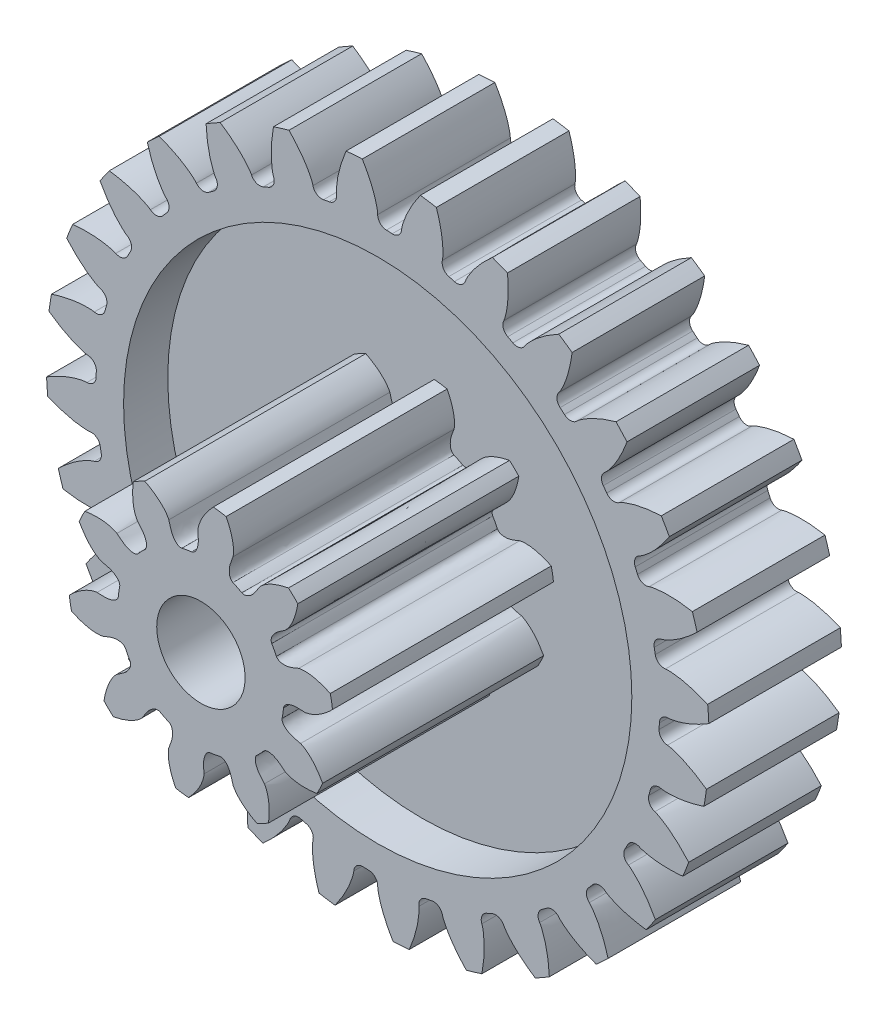
from build123d import *

# Parameters (mm, degrees)
ESQUISSE1_R             = 1
BOSS_EXTRU_1_DEPTH      = 3
ESQUISSE2_R             = 5.75
ENL_V_MAT_EXTRU_1_DEPTH = 1
ESQUISSE3_R             = 1
BOSS_EXTRU_2_DEPTH      = 5


with BuildPart() as part:
    # Esquisse1 → Boss.-Extru.1 (new body)
    with BuildSketch(Plane.XY):
        with BuildLine():
            ThreePointArc((7.491868518, 0.349150543), (7.48109955, 0.532117964), (7.465862795, 0.714767599))
            add(Edge.make_bspline(
                [(6.511775734, 0.931053619), (6.54533459, 0.935851864), (6.691230758, 0.932883331), (6.92755526, 0.897904294), (7.210754579, 0.816287714), (7.382633754, 0.750372838), (7.465862795, 0.714767599)],
                knots=[0, 0, 0, 0, 0.101700454, 0.434977009, 0.714423103, 0.984887496, 0.984887496, 0.984887496, 0.984887496], degree=3))
            ThreePointArc((6.511775734, 0.931053619), (6.361956751, 0.966352964), (6.279971624, 1.096622724))
            ThreePointArc((6.279971624, 1.096622724), (6.268309408, 1.161431083), (6.255978398, 1.226115524))
            ThreePointArc((6.255978398, 1.226115524), (6.285849036, 1.377110609), (6.413075806, 1.463742704))
            add(Edge.make_bspline(
                [(6.413075806, 1.463742704), (6.44612601, 1.471286197), (6.581273617, 1.526328257), (6.789378175, 1.643653855), (7.024536913, 1.821315017), (7.161390753, 1.944433854), (7.226338428, 2.00749419)],
                knots=[0, 0, 0, 0, 0.101700454, 0.434977009, 0.714423103, 0.984887496, 0.984887496, 0.984887496, 0.984887496], degree=3))
            ThreePointArc((7.226338428, 2.00749419), (7.175125379, 2.183477914), (7.119627274, 2.358157645))
            add(Edge.make_bspline(
                [(6.141333, 2.356716579), (6.172982756, 2.36886207), (6.315881563, 2.398432916), (6.554064484, 2.416918025), (6.848324803, 2.40036552), (7.030562047, 2.374349982), (7.119627274, 2.358157645)],
                knots=[0, 0, 0, 0, 0.101700454, 0.434977009, 0.714423103, 0.984887496, 0.984887496, 0.984887496, 0.984887496], degree=3))
            ThreePointArc((6.141333, 2.356716579), (5.987415449, 2.357793036), (5.878498112, 2.466553254))
            ThreePointArc((5.878498112, 2.466553254), (5.852707075, 2.527141645), (5.826291587, 2.587460404))
            ThreePointArc((5.826291587, 2.587460404), (5.821813738, 2.741316569), (5.926573213, 2.854087236))
            add(Edge.make_bspline(
                [(5.926573213, 2.854087236), (5.957116194, 2.86879596), (6.076627358, 2.952531173), (6.253406899, 3.113222794), (6.443136388, 3.338757362), (6.549162498, 3.489242196), (6.598449554, 3.565173695)],
                knots=[0, 0, 0, 0, 0.101700454, 0.434977009, 0.714423103, 0.984887496, 0.984887496, 0.984887496, 0.984887496], degree=3))
            ThreePointArc((6.598449554, 3.565173695), (6.50936046, 3.725349165), (6.416383912, 3.88329982))
            add(Edge.make_bspline(
                [(5.462938185, 3.664203929), (5.49109179, 3.683087641), (5.623827693, 3.743715059), (5.851925548, 3.814737394), (6.142491424, 3.864078976), (6.325948603, 3.879267303), (6.416383912, 3.88329982)],
                knots=[0, 0, 0, 0, 0.101700454, 0.434977009, 0.714423103, 0.984887496, 0.984887496, 0.984887496, 0.984887496], degree=3))
            ThreePointArc((5.462938185, 3.664203929), (5.312640134, 3.631003519), (5.182252157, 3.712800504))
            ThreePointArc((5.182252157, 3.712800504), (5.14362557, 3.766130772), (5.104450187, 3.819059215))
            ThreePointArc((5.104450187, 3.819059215), (5.06584839, 3.96806147), (5.142887492, 4.101315917))
            add(Edge.make_bspline(
                [(5.142887492, 4.101315917), (5.169391697, 4.122452315), (5.267273629, 4.230681847), (5.403863688, 4.426681742), (5.5386501, 4.688780471), (5.608531889, 4.859085365), (5.639686867, 4.944080505)],
                knots=[0, 0, 0, 0, 0.101700454, 0.434977009, 0.714423103, 0.984887496, 0.984887496, 0.984887496, 0.984887496], degree=3))
            ThreePointArc((5.639686867, 4.944080505), (5.517189028, 5.080415852), (5.391396269, 5.213717126))
            add(Edge.make_bspline(
                [(4.510608839, 4.787952794), (4.533854553, 4.812627817), (4.64977162, 4.901271697), (4.856346629, 5.021269902), (5.128647877, 5.134031378), (5.30412568, 5.189661964), (5.391396269, 5.213717126)],
                knots=[0, 0, 0, 0, 0.101700454, 0.434977009, 0.714423103, 0.984887496, 0.984887496, 0.984887496, 0.984887496], degree=3))
            ThreePointArc((4.510608839, 4.787952794), (4.37146686, 4.722140325), (4.22614644, 4.772872434))
            ThreePointArc((4.22614644, 4.772872434), (4.176621201, 4.816270376), (4.12665034, 4.85915445))
            ThreePointArc((4.12665034, 4.85915445), (4.05586025, 4.995831199), (4.101315917, 5.142887492))
            add(Edge.make_bspline(
                [(4.101315917, 5.142887492), (4.122452315, 5.169391697), (4.193796806, 5.296688467), (4.283348187, 5.518168384), (4.356432769, 5.803688548), (4.386666071, 5.985273704), (4.398126732, 6.075070473)],
                knots=[0, 0, 0, 0, 0.101700454, 0.434977009, 0.714423103, 0.984887496, 0.984887496, 0.984887496, 0.984887496], degree=3))
            ThreePointArc((4.398126732, 6.075070473), (4.248362699, 6.180729275), (4.096061504, 6.282696886))
            add(Edge.make_bspline(
                [(3.332098731, 5.671613712), (3.349270916, 5.700842739), (3.442556582, 5.813058106), (3.617250211, 5.976014969), (3.85763251, 6.146542008), (4.016331748, 6.239825304), (4.096061504, 6.282696886)],
                knots=[0, 0, 0, 0, 0.101700454, 0.434977009, 0.714423103, 0.984887496, 0.984887496, 0.984887496, 0.984887496], degree=3))
            ThreePointArc((3.332098731, 5.671613712), (3.211089984, 5.576489296), (3.058124094, 5.59361261))
            ThreePointArc((3.058124094, 5.59361261), (3.000183606, 5.624902073), (2.941923014, 5.655591391))
            ThreePointArc((2.941923014, 5.655591391), (2.842494341, 5.773089092), (2.854087236, 5.926573213))
            add(Edge.make_bspline(
                [(2.854087236, 5.926573213), (2.86879596, 5.957116194), (2.9100255, 6.097097011), (2.948047723, 6.33295102), (2.955765708, 6.627575448), (2.9448345, 6.811335427), (2.936026156, 6.901431041)],
                knots=[0, 0, 0, 0, 0.101700454, 0.434977009, 0.714423103, 0.984887496, 0.984887496, 0.984887496, 0.984887496], degree=3))
            ThreePointArc((2.936026156, 6.901431041), (2.766505726, 6.971115124), (2.595333111, 7.036635989))
            add(Edge.make_bspline(
                [(1.986503278, 6.270876237), (1.996740851, 6.303193602), (2.062717382, 6.433353509), (2.196769764, 6.631097693), (2.393179341, 6.850839356), (2.527142172, 6.977097748), (2.595333111, 7.036635989)],
                knots=[0, 0, 0, 0, 0.101700454, 0.434977009, 0.714423103, 0.984887496, 0.984887496, 0.984887496, 0.984887496], degree=3))
            ThreePointArc((1.986503278, 6.270876237), (1.889695647, 6.151209809), (1.736754636, 6.133865693))
            ThreePointArc((1.736754636, 6.133865693), (1.673304276, 6.151477692), (1.609675384, 6.168433363))
            ThreePointArc((1.609675384, 6.168433363), (1.486593897, 6.26086019), (1.463742704, 6.413075806))
            add(Edge.make_bspline(
                [(1.463742704, 6.413075806), (1.471286197, 6.44612601), (1.480333363, 6.591771651), (1.464919836, 6.830173049), (1.406884212, 7.11912804), (1.35533663, 7.295848351), (1.32670097, 7.381725038)],
                knots=[0, 0, 0, 0, 0.101700454, 0.434977009, 0.714423103, 0.984887496, 0.984887496, 0.984887496, 0.984887496], degree=3))
            ThreePointArc((1.32670097, 7.381725038), (1.145924603, 7.411940151), (0.964463879, 7.437728781))
            add(Edge.make_bspline(
                [(0.541296257, 6.555690842), (0.544085862, 6.589476018), (0.57944492, 6.731053703), (0.666134108, 6.953669488), (0.808722167, 7.211607012), (0.911231134, 7.364509376), (0.964463879, 7.437728781)],
                knots=[0, 0, 0, 0, 0.101700454, 0.434977009, 0.714423103, 0.984887496, 0.984887496, 0.984887496, 0.984887496], degree=3))
            ThreePointArc((0.541296257, 6.555690842), (0.47354408, 6.417482977), (0.328297049, 6.366541137))
            ThreePointArc((0.328297049, 6.366541137), (0.262518483, 6.369592534), (0.196711908, 6.37196433))
            ThreePointArc((0.196711908, 6.37196433), (0.056149427, 6.434685616), (0, 6.578))
            add(Edge.make_bspline(
                [(0, 6.578), (0, 6.611900151), (-0.023588869, 6.755907336), (-0.091665249, 6.984901681), (-0.212544333, 7.253697825), (-0.302123478, 7.414516973), (-0.349150543, 7.491868518)],
                knots=[0, 0, 0, 0, 0.101700454, 0.434977009, 0.714423103, 0.984887496, 0.984887496, 0.984887496, 0.984887496], degree=3))
            ThreePointArc((-0.349150543, 7.491868518), (-0.532117964, 7.48109955), (-0.714767599, 7.465862795))
            add(Edge.make_bspline(
                [(-0.931053619, 6.511775734), (-0.935851864, 6.54533459), (-0.932883331, 6.691230758), (-0.897904294, 6.92755526), (-0.816287714, 7.210754579), (-0.750372838, 7.382633754), (-0.714767599, 7.465862795)],
                knots=[0, 0, 0, 0, 0.101700454, 0.434977009, 0.714423103, 0.984887496, 0.984887496, 0.984887496, 0.984887496], degree=3))
            ThreePointArc((-0.931053619, 6.511775734), (-0.966352964, 6.361956751), (-1.096622724, 6.279971624))
            ThreePointArc((-1.096622724, 6.279971624), (-1.161431083, 6.268309408), (-1.226115524, 6.255978398))
            ThreePointArc((-1.226115524, 6.255978398), (-1.377110609, 6.285849036), (-1.463742704, 6.413075806))
            add(Edge.make_bspline(
                [(-1.463742704, 6.413075806), (-1.471286197, 6.44612601), (-1.526328257, 6.581273617), (-1.643653855, 6.789378175), (-1.821315017, 7.024536913), (-1.944433854, 7.161390753), (-2.00749419, 7.226338428)],
                knots=[0, 0, 0, 0, 0.101700454, 0.434977009, 0.714423103, 0.984887496, 0.984887496, 0.984887496, 0.984887496], degree=3))
            ThreePointArc((-2.00749419, 7.226338428), (-2.183477914, 7.175125379), (-2.358157645, 7.119627274))
            add(Edge.make_bspline(
                [(-2.356716579, 6.141333), (-2.36886207, 6.172982756), (-2.398432916, 6.315881563), (-2.416918025, 6.554064484), (-2.40036552, 6.848324803), (-2.374349982, 7.030562047), (-2.358157645, 7.119627274)],
                knots=[0, 0, 0, 0, 0.101700454, 0.434977009, 0.714423103, 0.984887496, 0.984887496, 0.984887496, 0.984887496], degree=3))
            ThreePointArc((-2.356716579, 6.141333), (-2.357793036, 5.987415449), (-2.466553254, 5.878498112))
            ThreePointArc((-2.466553254, 5.878498112), (-2.527141645, 5.852707075), (-2.587460404, 5.826291587))
            ThreePointArc((-2.587460404, 5.826291587), (-2.741316569, 5.821813738), (-2.854087236, 5.926573213))
            add(Edge.make_bspline(
                [(-2.854087236, 5.926573213), (-2.86879596, 5.957116194), (-2.952531173, 6.076627358), (-3.113222794, 6.253406899), (-3.338757362, 6.443136388), (-3.489242196, 6.549162498), (-3.565173695, 6.598449554)],
                knots=[0, 0, 0, 0, 0.101700454, 0.434977009, 0.714423103, 0.984887496, 0.984887496, 0.984887496, 0.984887496], degree=3))
            ThreePointArc((-3.565173695, 6.598449554), (-3.725349165, 6.50936046), (-3.88329982, 6.416383912))
            add(Edge.make_bspline(
                [(-3.664203929, 5.462938185), (-3.683087641, 5.49109179), (-3.743715059, 5.623827693), (-3.814737394, 5.851925548), (-3.864078976, 6.142491424), (-3.879267303, 6.325948603), (-3.88329982, 6.416383912)],
                knots=[0, 0, 0, 0, 0.101700454, 0.434977009, 0.714423103, 0.984887496, 0.984887496, 0.984887496, 0.984887496], degree=3))
            ThreePointArc((-3.664203929, 5.462938185), (-3.631003519, 5.312640134), (-3.712800504, 5.182252157))
            ThreePointArc((-3.712800504, 5.182252157), (-3.766130772, 5.14362557), (-3.819059215, 5.104450187))
            ThreePointArc((-3.819059215, 5.104450187), (-3.96806147, 5.06584839), (-4.101315917, 5.142887492))
            add(Edge.make_bspline(
                [(-4.101315917, 5.142887492), (-4.122452315, 5.169391697), (-4.230681847, 5.267273629), (-4.426681742, 5.403863688), (-4.688780471, 5.5386501), (-4.859085365, 5.608531889), (-4.944080505, 5.639686867)],
                knots=[0, 0, 0, 0, 0.101700454, 0.434977009, 0.714423103, 0.984887496, 0.984887496, 0.984887496, 0.984887496], degree=3))
            ThreePointArc((-4.944080505, 5.639686867), (-5.080415852, 5.517189028), (-5.213717126, 5.391396269))
            add(Edge.make_bspline(
                [(-4.787952794, 4.510608839), (-4.812627817, 4.533854553), (-4.901271697, 4.64977162), (-5.021269902, 4.856346629), (-5.134031378, 5.128647877), (-5.189661964, 5.30412568), (-5.213717126, 5.391396269)],
                knots=[0, 0, 0, 0, 0.101700454, 0.434977009, 0.714423103, 0.984887496, 0.984887496, 0.984887496, 0.984887496], degree=3))
            ThreePointArc((-4.787952794, 4.510608839), (-4.722140325, 4.37146686), (-4.772872434, 4.22614644))
            ThreePointArc((-4.772872434, 4.22614644), (-4.816270376, 4.176621201), (-4.85915445, 4.12665034))
            ThreePointArc((-4.85915445, 4.12665034), (-4.995831199, 4.05586025), (-5.142887492, 4.101315917))
            add(Edge.make_bspline(
                [(-5.142887492, 4.101315917), (-5.169391697, 4.122452315), (-5.296688467, 4.193796806), (-5.518168384, 4.283348187), (-5.803688548, 4.356432769), (-5.985273704, 4.386666071), (-6.075070473, 4.398126732)],
                knots=[0, 0, 0, 0, 0.101700454, 0.434977009, 0.714423103, 0.984887496, 0.984887496, 0.984887496, 0.984887496], degree=3))
            ThreePointArc((-6.075070473, 4.398126732), (-6.180729275, 4.248362699), (-6.282696886, 4.096061504))
            add(Edge.make_bspline(
                [(-5.671613712, 3.332098731), (-5.700842739, 3.349270916), (-5.813058106, 3.442556582), (-5.976014969, 3.617250211), (-6.146542008, 3.85763251), (-6.239825304, 4.016331748), (-6.282696886, 4.096061504)],
                knots=[0, 0, 0, 0, 0.101700454, 0.434977009, 0.714423103, 0.984887496, 0.984887496, 0.984887496, 0.984887496], degree=3))
            ThreePointArc((-5.671613712, 3.332098731), (-5.576489296, 3.211089984), (-5.59361261, 3.058124094))
            ThreePointArc((-5.59361261, 3.058124094), (-5.624902073, 3.000183606), (-5.655591391, 2.941923014))
            ThreePointArc((-5.655591391, 2.941923014), (-5.773089092, 2.842494341), (-5.926573213, 2.854087236))
            add(Edge.make_bspline(
                [(-5.926573213, 2.854087236), (-5.957116194, 2.86879596), (-6.097097011, 2.9100255), (-6.33295102, 2.948047723), (-6.627575448, 2.955765708), (-6.811335427, 2.9448345), (-6.901431041, 2.936026156)],
                knots=[0, 0, 0, 0, 0.101700454, 0.434977009, 0.714423103, 0.984887496, 0.984887496, 0.984887496, 0.984887496], degree=3))
            ThreePointArc((-6.901431041, 2.936026156), (-6.971115124, 2.766505726), (-7.036635989, 2.595333111))
            add(Edge.make_bspline(
                [(-6.270876237, 1.986503278), (-6.303193602, 1.996740851), (-6.433353509, 2.062717382), (-6.631097693, 2.196769764), (-6.850839356, 2.393179341), (-6.977097748, 2.527142172), (-7.036635989, 2.595333111)],
                knots=[0, 0, 0, 0, 0.101700454, 0.434977009, 0.714423103, 0.984887496, 0.984887496, 0.984887496, 0.984887496], degree=3))
            ThreePointArc((-6.270876237, 1.986503278), (-6.151209809, 1.889695647), (-6.133865693, 1.736754636))
            ThreePointArc((-6.133865693, 1.736754636), (-6.151477692, 1.673304276), (-6.168433363, 1.609675384))
            ThreePointArc((-6.168433363, 1.609675384), (-6.26086019, 1.486593897), (-6.413075806, 1.463742704))
            add(Edge.make_bspline(
                [(-6.413075806, 1.463742704), (-6.44612601, 1.471286197), (-6.591771651, 1.480333363), (-6.830173049, 1.464919836), (-7.11912804, 1.406884212), (-7.295848351, 1.35533663), (-7.381725038, 1.32670097)],
                knots=[0, 0, 0, 0, 0.101700454, 0.434977009, 0.714423103, 0.984887496, 0.984887496, 0.984887496, 0.984887496], degree=3))
            ThreePointArc((-7.381725038, 1.32670097), (-7.411940151, 1.145924603), (-7.437728781, 0.964463879))
            add(Edge.make_bspline(
                [(-6.555690842, 0.541296257), (-6.589476018, 0.544085862), (-6.731053703, 0.57944492), (-6.953669488, 0.666134108), (-7.211607012, 0.808722167), (-7.364509376, 0.911231134), (-7.437728781, 0.964463879)],
                knots=[0, 0, 0, 0, 0.101700454, 0.434977009, 0.714423103, 0.984887496, 0.984887496, 0.984887496, 0.984887496], degree=3))
            ThreePointArc((-6.555690842, 0.541296257), (-6.417482977, 0.47354408), (-6.366541137, 0.328297049))
            ThreePointArc((-6.366541137, 0.328297049), (-6.369592534, 0.262518483), (-6.37196433, 0.196711908))
            ThreePointArc((-6.37196433, 0.196711908), (-6.434685616, 0.056149427), (-6.578, 0))
            add(Edge.make_bspline(
                [(-6.578, 0), (-6.611900151, 0), (-6.755907336, -0.023588869), (-6.984901681, -0.091665249), (-7.253697825, -0.212544333), (-7.414516973, -0.302123478), (-7.491868518, -0.349150543)],
                knots=[0, 0, 0, 0, 0.101700454, 0.434977009, 0.714423103, 0.984887496, 0.984887496, 0.984887496, 0.984887496], degree=3))
            ThreePointArc((-7.491868518, -0.349150543), (-7.48109955, -0.532117964), (-7.465862795, -0.714767599))
            add(Edge.make_bspline(
                [(-6.511775734, -0.931053619), (-6.54533459, -0.935851864), (-6.691230758, -0.932883331), (-6.92755526, -0.897904294), (-7.210754579, -0.816287714), (-7.382633754, -0.750372838), (-7.465862795, -0.714767599)],
                knots=[0, 0, 0, 0, 0.101700454, 0.434977009, 0.714423103, 0.984887496, 0.984887496, 0.984887496, 0.984887496], degree=3))
            ThreePointArc((-6.511775734, -0.931053619), (-6.361956751, -0.966352964), (-6.279971624, -1.096622724))
            ThreePointArc((-6.279971624, -1.096622724), (-6.268309408, -1.161431083), (-6.255978398, -1.226115524))
            ThreePointArc((-6.255978398, -1.226115524), (-6.285849036, -1.377110609), (-6.413075806, -1.463742704))
            add(Edge.make_bspline(
                [(-6.413075806, -1.463742704), (-6.44612601, -1.471286197), (-6.581273617, -1.526328257), (-6.789378175, -1.643653855), (-7.024536913, -1.821315017), (-7.161390753, -1.944433854), (-7.226338428, -2.00749419)],
                knots=[0, 0, 0, 0, 0.101700454, 0.434977009, 0.714423103, 0.984887496, 0.984887496, 0.984887496, 0.984887496], degree=3))
            ThreePointArc((-7.226338428, -2.00749419), (-7.175125379, -2.183477914), (-7.119627274, -2.358157645))
            add(Edge.make_bspline(
                [(-6.141333, -2.356716579), (-6.172982756, -2.36886207), (-6.315881563, -2.398432916), (-6.554064484, -2.416918025), (-6.848324803, -2.40036552), (-7.030562047, -2.374349982), (-7.119627274, -2.358157645)],
                knots=[0, 0, 0, 0, 0.101700454, 0.434977009, 0.714423103, 0.984887496, 0.984887496, 0.984887496, 0.984887496], degree=3))
            ThreePointArc((-6.141333, -2.356716579), (-5.987415449, -2.357793036), (-5.878498112, -2.466553254))
            ThreePointArc((-5.878498112, -2.466553254), (-5.852707075, -2.527141645), (-5.826291587, -2.587460404))
            ThreePointArc((-5.826291587, -2.587460404), (-5.821813738, -2.741316569), (-5.926573213, -2.854087236))
            add(Edge.make_bspline(
                [(-5.926573213, -2.854087236), (-5.957116194, -2.86879596), (-6.076627358, -2.952531173), (-6.253406899, -3.113222794), (-6.443136388, -3.338757362), (-6.549162498, -3.489242196), (-6.598449554, -3.565173695)],
                knots=[0, 0, 0, 0, 0.101700454, 0.434977009, 0.714423103, 0.984887496, 0.984887496, 0.984887496, 0.984887496], degree=3))
            ThreePointArc((-6.598449554, -3.565173695), (-6.50936046, -3.725349165), (-6.416383912, -3.88329982))
            add(Edge.make_bspline(
                [(-5.462938185, -3.664203929), (-5.49109179, -3.683087641), (-5.623827693, -3.743715059), (-5.851925548, -3.814737394), (-6.142491424, -3.864078976), (-6.325948603, -3.879267303), (-6.416383912, -3.88329982)],
                knots=[0, 0, 0, 0, 0.101700454, 0.434977009, 0.714423103, 0.984887496, 0.984887496, 0.984887496, 0.984887496], degree=3))
            ThreePointArc((-5.462938185, -3.664203929), (-5.312640134, -3.631003519), (-5.182252157, -3.712800504))
            ThreePointArc((-5.182252157, -3.712800504), (-5.14362557, -3.766130772), (-5.104450187, -3.819059215))
            ThreePointArc((-5.104450187, -3.819059215), (-5.06584839, -3.96806147), (-5.142887492, -4.101315917))
            add(Edge.make_bspline(
                [(-5.142887492, -4.101315917), (-5.169391697, -4.122452315), (-5.267273629, -4.230681847), (-5.403863688, -4.426681742), (-5.5386501, -4.688780471), (-5.608531889, -4.859085365), (-5.639686867, -4.944080505)],
                knots=[0, 0, 0, 0, 0.101700454, 0.434977009, 0.714423103, 0.984887496, 0.984887496, 0.984887496, 0.984887496], degree=3))
            ThreePointArc((-5.639686867, -4.944080505), (-5.517189028, -5.080415852), (-5.391396269, -5.213717126))
            add(Edge.make_bspline(
                [(-4.510608839, -4.787952794), (-4.533854553, -4.812627817), (-4.64977162, -4.901271697), (-4.856346629, -5.021269902), (-5.128647877, -5.134031378), (-5.30412568, -5.189661964), (-5.391396269, -5.213717126)],
                knots=[0, 0, 0, 0, 0.101700454, 0.434977009, 0.714423103, 0.984887496, 0.984887496, 0.984887496, 0.984887496], degree=3))
            ThreePointArc((-4.510608839, -4.787952794), (-4.37146686, -4.722140325), (-4.22614644, -4.772872434))
            ThreePointArc((-4.22614644, -4.772872434), (-4.176621201, -4.816270376), (-4.12665034, -4.85915445))
            ThreePointArc((-4.12665034, -4.85915445), (-4.05586025, -4.995831199), (-4.101315917, -5.142887492))
            add(Edge.make_bspline(
                [(-4.101315917, -5.142887492), (-4.122452315, -5.169391697), (-4.193796806, -5.296688467), (-4.283348187, -5.518168384), (-4.356432769, -5.803688548), (-4.386666071, -5.985273704), (-4.398126732, -6.075070473)],
                knots=[0, 0, 0, 0, 0.101700454, 0.434977009, 0.714423103, 0.984887496, 0.984887496, 0.984887496, 0.984887496], degree=3))
            ThreePointArc((-4.398126732, -6.075070473), (-4.248362699, -6.180729275), (-4.096061504, -6.282696886))
            add(Edge.make_bspline(
                [(-3.332098731, -5.671613712), (-3.349270916, -5.700842739), (-3.442556582, -5.813058106), (-3.617250211, -5.976014969), (-3.85763251, -6.146542008), (-4.016331748, -6.239825304), (-4.096061504, -6.282696886)],
                knots=[0, 0, 0, 0, 0.101700454, 0.434977009, 0.714423103, 0.984887496, 0.984887496, 0.984887496, 0.984887496], degree=3))
            ThreePointArc((-3.332098731, -5.671613712), (-3.211089984, -5.576489296), (-3.058124094, -5.59361261))
            ThreePointArc((-3.058124094, -5.59361261), (-3.000183606, -5.624902073), (-2.941923014, -5.655591391))
            ThreePointArc((-2.941923014, -5.655591391), (-2.842494341, -5.773089092), (-2.854087236, -5.926573213))
            add(Edge.make_bspline(
                [(-2.854087236, -5.926573213), (-2.86879596, -5.957116194), (-2.9100255, -6.097097011), (-2.948047723, -6.33295102), (-2.955765708, -6.627575448), (-2.9448345, -6.811335427), (-2.936026156, -6.901431041)],
                knots=[0, 0, 0, 0, 0.101700454, 0.434977009, 0.714423103, 0.984887496, 0.984887496, 0.984887496, 0.984887496], degree=3))
            ThreePointArc((-2.936026156, -6.901431041), (-2.766505726, -6.971115124), (-2.595333111, -7.036635989))
            add(Edge.make_bspline(
                [(-1.986503278, -6.270876237), (-1.996740851, -6.303193602), (-2.062717382, -6.433353509), (-2.196769764, -6.631097693), (-2.393179341, -6.850839356), (-2.527142172, -6.977097748), (-2.595333111, -7.036635989)],
                knots=[0, 0, 0, 0, 0.101700454, 0.434977009, 0.714423103, 0.984887496, 0.984887496, 0.984887496, 0.984887496], degree=3))
            ThreePointArc((-1.986503278, -6.270876237), (-1.889695647, -6.151209809), (-1.736754636, -6.133865693))
            ThreePointArc((-1.736754636, -6.133865693), (-1.673304276, -6.151477692), (-1.609675384, -6.168433363))
            ThreePointArc((-1.609675384, -6.168433363), (-1.486593897, -6.26086019), (-1.463742704, -6.413075806))
            add(Edge.make_bspline(
                [(-1.463742704, -6.413075806), (-1.471286197, -6.44612601), (-1.480333363, -6.591771651), (-1.464919836, -6.830173049), (-1.406884212, -7.11912804), (-1.35533663, -7.295848351), (-1.32670097, -7.381725038)],
                knots=[0, 0, 0, 0, 0.101700454, 0.434977009, 0.714423103, 0.984887496, 0.984887496, 0.984887496, 0.984887496], degree=3))
            ThreePointArc((-1.32670097, -7.381725038), (-1.145924603, -7.411940151), (-0.964463879, -7.437728781))
            add(Edge.make_bspline(
                [(-0.541296257, -6.555690842), (-0.544085862, -6.589476018), (-0.57944492, -6.731053703), (-0.666134108, -6.953669488), (-0.808722167, -7.211607012), (-0.911231134, -7.364509376), (-0.964463879, -7.437728781)],
                knots=[0, 0, 0, 0, 0.101700454, 0.434977009, 0.714423103, 0.984887496, 0.984887496, 0.984887496, 0.984887496], degree=3))
            ThreePointArc((-0.541296257, -6.555690842), (-0.47354408, -6.417482977), (-0.328297049, -6.366541137))
            ThreePointArc((-0.328297049, -6.366541137), (-0.262518483, -6.369592534), (-0.196711908, -6.37196433))
            ThreePointArc((-0.196711908, -6.37196433), (-0.056149427, -6.434685616), (0, -6.578))
            add(Edge.make_bspline(
                [(0, -6.578), (0, -6.611900151), (0.023588869, -6.755907336), (0.091665249, -6.984901681), (0.212544333, -7.253697825), (0.302123478, -7.414516973), (0.349150543, -7.491868518)],
                knots=[0, 0, 0, 0, 0.101700454, 0.434977009, 0.714423103, 0.984887496, 0.984887496, 0.984887496, 0.984887496], degree=3))
            ThreePointArc((0.349150543, -7.491868518), (0.532117964, -7.48109955), (0.714767599, -7.465862795))
            add(Edge.make_bspline(
                [(0.931053619, -6.511775734), (0.935851864, -6.54533459), (0.932883331, -6.691230758), (0.897904294, -6.92755526), (0.816287714, -7.210754579), (0.750372838, -7.382633754), (0.714767599, -7.465862795)],
                knots=[0, 0, 0, 0, 0.101700454, 0.434977009, 0.714423103, 0.984887496, 0.984887496, 0.984887496, 0.984887496], degree=3))
            ThreePointArc((0.931053619, -6.511775734), (0.966352964, -6.361956751), (1.096622724, -6.279971624))
            ThreePointArc((1.096622724, -6.279971624), (1.161431083, -6.268309408), (1.226115524, -6.255978398))
            ThreePointArc((1.226115524, -6.255978398), (1.377110609, -6.285849036), (1.463742704, -6.413075806))
            add(Edge.make_bspline(
                [(1.463742704, -6.413075806), (1.471286197, -6.44612601), (1.526328257, -6.581273617), (1.643653855, -6.789378175), (1.821315017, -7.024536913), (1.944433854, -7.161390753), (2.00749419, -7.226338428)],
                knots=[0, 0, 0, 0, 0.101700454, 0.434977009, 0.714423103, 0.984887496, 0.984887496, 0.984887496, 0.984887496], degree=3))
            ThreePointArc((2.00749419, -7.226338428), (2.183477914, -7.175125379), (2.358157645, -7.119627274))
            add(Edge.make_bspline(
                [(2.356716579, -6.141333), (2.36886207, -6.172982756), (2.398432916, -6.315881563), (2.416918025, -6.554064484), (2.40036552, -6.848324803), (2.374349982, -7.030562047), (2.358157645, -7.119627274)],
                knots=[0, 0, 0, 0, 0.101700454, 0.434977009, 0.714423103, 0.984887496, 0.984887496, 0.984887496, 0.984887496], degree=3))
            ThreePointArc((2.356716579, -6.141333), (2.357793036, -5.987415449), (2.466553254, -5.878498112))
            ThreePointArc((2.466553254, -5.878498112), (2.527141645, -5.852707075), (2.587460404, -5.826291587))
            ThreePointArc((2.587460404, -5.826291587), (2.741316569, -5.821813738), (2.854087236, -5.926573213))
            add(Edge.make_bspline(
                [(2.854087236, -5.926573213), (2.86879596, -5.957116194), (2.952531173, -6.076627358), (3.113222794, -6.253406899), (3.338757362, -6.443136388), (3.489242196, -6.549162498), (3.565173695, -6.598449554)],
                knots=[0, 0, 0, 0, 0.101700454, 0.434977009, 0.714423103, 0.984887496, 0.984887496, 0.984887496, 0.984887496], degree=3))
            ThreePointArc((3.565173695, -6.598449554), (3.725349165, -6.50936046), (3.88329982, -6.416383912))
            add(Edge.make_bspline(
                [(3.664203929, -5.462938185), (3.683087641, -5.49109179), (3.743715059, -5.623827693), (3.814737394, -5.851925548), (3.864078976, -6.142491424), (3.879267303, -6.325948603), (3.88329982, -6.416383912)],
                knots=[0, 0, 0, 0, 0.101700454, 0.434977009, 0.714423103, 0.984887496, 0.984887496, 0.984887496, 0.984887496], degree=3))
            ThreePointArc((3.664203929, -5.462938185), (3.631003519, -5.312640134), (3.712800504, -5.182252157))
            ThreePointArc((3.712800504, -5.182252157), (3.766130772, -5.14362557), (3.819059215, -5.104450187))
            ThreePointArc((3.819059215, -5.104450187), (3.96806147, -5.06584839), (4.101315917, -5.142887492))
            add(Edge.make_bspline(
                [(4.101315917, -5.142887492), (4.122452315, -5.169391697), (4.230681847, -5.267273629), (4.426681742, -5.403863688), (4.688780471, -5.5386501), (4.859085365, -5.608531889), (4.944080505, -5.639686867)],
                knots=[0, 0, 0, 0, 0.101700454, 0.434977009, 0.714423103, 0.984887496, 0.984887496, 0.984887496, 0.984887496], degree=3))
            ThreePointArc((4.944080505, -5.639686867), (5.080415852, -5.517189028), (5.213717126, -5.391396269))
            add(Edge.make_bspline(
                [(4.787952794, -4.510608839), (4.812627817, -4.533854553), (4.901271697, -4.64977162), (5.021269902, -4.856346629), (5.134031378, -5.128647877), (5.189661964, -5.30412568), (5.213717126, -5.391396269)],
                knots=[0, 0, 0, 0, 0.101700454, 0.434977009, 0.714423103, 0.984887496, 0.984887496, 0.984887496, 0.984887496], degree=3))
            ThreePointArc((4.787952794, -4.510608839), (4.722140325, -4.37146686), (4.772872434, -4.22614644))
            ThreePointArc((4.772872434, -4.22614644), (4.816270376, -4.176621201), (4.85915445, -4.12665034))
            ThreePointArc((4.85915445, -4.12665034), (4.995831199, -4.05586025), (5.142887492, -4.101315917))
            add(Edge.make_bspline(
                [(5.142887492, -4.101315917), (5.169391697, -4.122452315), (5.296688467, -4.193796806), (5.518168384, -4.283348187), (5.803688548, -4.356432769), (5.985273704, -4.386666071), (6.075070473, -4.398126732)],
                knots=[0, 0, 0, 0, 0.101700454, 0.434977009, 0.714423103, 0.984887496, 0.984887496, 0.984887496, 0.984887496], degree=3))
            ThreePointArc((6.075070473, -4.398126732), (6.180729275, -4.248362699), (6.282696886, -4.096061504))
            add(Edge.make_bspline(
                [(5.671613712, -3.332098731), (5.700842739, -3.349270916), (5.813058106, -3.442556582), (5.976014969, -3.617250211), (6.146542008, -3.85763251), (6.239825304, -4.016331748), (6.282696886, -4.096061504)],
                knots=[0, 0, 0, 0, 0.101700454, 0.434977009, 0.714423103, 0.984887496, 0.984887496, 0.984887496, 0.984887496], degree=3))
            ThreePointArc((5.671613712, -3.332098731), (5.576489296, -3.211089984), (5.59361261, -3.058124094))
            ThreePointArc((5.59361261, -3.058124094), (5.624902073, -3.000183606), (5.655591391, -2.941923014))
            ThreePointArc((5.655591391, -2.941923014), (5.773089092, -2.842494341), (5.926573213, -2.854087236))
            add(Edge.make_bspline(
                [(5.926573213, -2.854087236), (5.957116194, -2.86879596), (6.097097011, -2.9100255), (6.33295102, -2.948047723), (6.627575448, -2.955765708), (6.811335427, -2.9448345), (6.901431041, -2.936026156)],
                knots=[0, 0, 0, 0, 0.101700454, 0.434977009, 0.714423103, 0.984887496, 0.984887496, 0.984887496, 0.984887496], degree=3))
            ThreePointArc((6.901431041, -2.936026156), (6.971115124, -2.766505726), (7.036635989, -2.595333111))
            add(Edge.make_bspline(
                [(6.270876237, -1.986503278), (6.303193602, -1.996740851), (6.433353509, -2.062717382), (6.631097693, -2.196769764), (6.850839356, -2.393179341), (6.977097748, -2.527142172), (7.036635989, -2.595333111)],
                knots=[0, 0, 0, 0, 0.101700454, 0.434977009, 0.714423103, 0.984887496, 0.984887496, 0.984887496, 0.984887496], degree=3))
            ThreePointArc((6.270876237, -1.986503278), (6.151209809, -1.889695647), (6.133865693, -1.736754636))
            ThreePointArc((6.133865693, -1.736754636), (6.151477692, -1.673304276), (6.168433363, -1.609675384))
            ThreePointArc((6.168433363, -1.609675384), (6.26086019, -1.486593897), (6.413075806, -1.463742704))
            add(Edge.make_bspline(
                [(6.413075806, -1.463742704), (6.44612601, -1.471286197), (6.591771651, -1.480333363), (6.830173049, -1.464919836), (7.11912804, -1.406884212), (7.295848351, -1.35533663), (7.381725038, -1.32670097)],
                knots=[0, 0, 0, 0, 0.101700454, 0.434977009, 0.714423103, 0.984887496, 0.984887496, 0.984887496, 0.984887496], degree=3))
            ThreePointArc((7.381725038, -1.32670097), (7.411940151, -1.145924603), (7.437728781, -0.964463879))
            add(Edge.make_bspline(
                [(6.555690842, -0.541296257), (6.589476018, -0.544085862), (6.731053703, -0.57944492), (6.953669488, -0.666134108), (7.211607012, -0.808722167), (7.364509376, -0.911231134), (7.437728781, -0.964463879)],
                knots=[0, 0, 0, 0, 0.101700454, 0.434977009, 0.714423103, 0.984887496, 0.984887496, 0.984887496, 0.984887496], degree=3))
            ThreePointArc((6.555690842, -0.541296257), (6.417482977, -0.47354408), (6.366541137, -0.328297049))
            ThreePointArc((6.366541137, -0.328297049), (6.369592534, -0.262518483), (6.37196433, -0.196711908))
            ThreePointArc((6.37196433, -0.196711908), (6.434685616, -0.056149427), (6.578, 0))
            add(Edge.make_bspline(
                [(6.578, 0), (6.611900151, 0), (6.755907336, 0.023588869), (6.984901681, 0.091665249), (7.253697825, 0.212544333), (7.414516973, 0.302123478), (7.491868518, 0.349150543)],
                knots=[0, 0, 0, 0, 0.101700454, 0.434977009, 0.714423103, 0.984887496, 0.984887496, 0.984887496, 0.984887496], degree=3))
        make_face()
        Circle(ESQUISSE1_R, mode=Mode.SUBTRACT)
    extrude(amount=BOSS_EXTRU_1_DEPTH)

    # Esquisse2 → Enlèv. mat.-Extru.1 (cut)
    with BuildSketch(Plane.XY.offset(3)):
        Circle(ESQUISSE2_R)
    extrude(amount=-ENL_V_MAT_EXTRU_1_DEPTH, mode=Mode.SUBTRACT)

    # Esquisse3 → Boss.-Extru.2 (add)
    with BuildSketch(Plane.XY.offset(2)):
        with BuildLine():
            ThreePointArc((2.977310095, 0.368272455), (2.955741127, 0.513414445), (2.927100903, 0.657328154))
            add(Edge.make_bspline(
                [(2.211403727, 0.79214554), (2.222779445, 0.796220429), (2.274133198, 0.805614359), (2.359373738, 0.810478726), (2.538607422, 0.796225963), (2.732062921, 0.744216047), (2.878239296, 0.681280138), (2.927100903, 0.657328154)],
                knots=[0, 0, 0, 0, 0.036250587, 0.155621312, 0.255291203, 0.575254513, 0.744084786, 0.744084786, 0.744084786, 0.744084786], degree=3))
            add(Edge.make_bspline(
                [(2.211403727, 0.79214554), (2.132130324, 0.763749064), (1.99001212, 0.681956821), (1.750090704, 0.694113528), (1.707279056, 0.775127876)],
                knots=[0, 0, 0, 0, 0.252617676, 0.527509393, 0.527509393, 0.527509393, 0.527509393], degree=3))
            ThreePointArc((1.707279056, 0.775127876), (1.657764419, 0.876037746), (1.602292085, 0.973799299))
            add(Edge.make_bspline(
                [(1.90038092, 1.380707558), (1.832256922, 1.331212576), (1.684611138, 1.259880414), (1.559480437, 1.054813647), (1.602292085, 0.973799299)],
                knots=[0, 0, 0, 0, 0.252617676, 0.527509393, 0.527509393, 0.527509393, 0.527509393], degree=3))
            add(Edge.make_bspline(
                [(1.90038092, 1.380707558), (1.9101567, 1.387810078), (1.946851003, 1.424944725), (1.998895263, 1.49262786), (2.088102134, 1.648736761), (2.154127637, 1.837868182), (2.184488772, 1.994094501), (2.192229346, 2.04795764)],
                knots=[0, 0, 0, 0, 0.036250587, 0.155621312, 0.255291203, 0.575254513, 0.744084786, 0.744084786, 0.744084786, 0.744084786], degree=3))
            ThreePointArc((2.192229346, 2.04795764), (2.089467363, 2.152702055), (1.98170658, 2.25229639))
            add(Edge.make_bspline(
                [(1.32345173, 1.940689701), (1.33025972, 1.950672835), (1.366284165, 1.988457663), (1.432386008, 2.04249615), (1.585766668, 2.136316339), (1.772846116, 2.207949723), (1.928098087, 2.242953821), (1.98170658, 2.25229639)],
                knots=[0, 0, 0, 0, 0.036250587, 0.155621312, 0.255291203, 0.575254513, 0.744084786, 0.744084786, 0.744084786, 0.744084786], degree=3))
            add(Edge.make_bspline(
                [(1.32345173, 1.940689701), (1.27600923, 1.871120733), (1.209109462, 1.721414433), (1.007863426, 1.590227146), (0.925609036, 1.630605075)],
                knots=[0, 0, 0, 0, 0.252617676, 0.527509393, 0.527509393, 0.527509393, 0.527509393], degree=3))
            ThreePointArc((0.925609036, 1.630605075), (0.82623752, 1.683138901), (0.72389666, 1.729623839))
            add(Edge.make_bspline(
                [(0.72588092, 2.234031757), (0.699859868, 2.153947194), (0.622339913, 2.009454248), (0.641642271, 1.770001768), (0.72389666, 1.729623839)],
                knots=[0, 0, 0, 0, 0.252617676, 0.527509393, 0.527509393, 0.527509393, 0.527509393], degree=3))
            add(Edge.make_bspline(
                [(0.72588092, 2.234031757), (0.729614936, 2.245523876), (0.737474053, 2.297134806), (0.739795594, 2.382482461), (0.720206959, 2.561211698), (0.662454053, 2.753031049), (0.595189201, 2.897266624), (0.569791499, 2.945392614)],
                knots=[0, 0, 0, 0, 0.036250587, 0.155621312, 0.255291203, 0.575254513, 0.744084786, 0.744084786, 0.744084786, 0.744084786], degree=3))
            ThreePointArc((0.569791499, 2.945392614), (0.425088085, 2.969730648), (0.279367699, 2.986963958))
            add(Edge.make_bspline(
                [(-0.070013845, 2.347956359), (-0.070374004, 2.360034519), (-0.063438981, 2.411777724), (-0.041724492, 2.494349468), (0.027216945, 2.660406485), (0.136462351, 2.82832165), (0.241488941, 2.947895379), (0.279367699, 2.986963958)],
                knots=[0, 0, 0, 0, 0.036250587, 0.155621312, 0.255291203, 0.575254513, 0.744084786, 0.744084786, 0.744084786, 0.744084786], degree=3))
            add(Edge.make_bspline(
                [(-0.070013845, 2.347956359), (-0.06750402, 2.263787878), (-0.033631914, 2.103350241), (-0.119333425, 1.878928045), (-0.209612175, 1.863246558)],
                knots=[0, 0, 0, 0, 0.252617676, 0.527509393, 0.527509393, 0.527509393, 0.527509393], degree=3))
            ThreePointArc((-0.209612175, 1.863246558), (-0.320884028, 1.847338204), (-0.431002684, 1.824790861))
            add(Edge.make_bspline(
                [(-0.72588092, 2.234031757), (-0.699859868, 2.153947194), (-0.677644007, 1.991484859), (-0.521281435, 1.809109374), (-0.431002684, 1.824790861)],
                knots=[0, 0, 0, 0, 0.252617676, 0.527509393, 0.527509393, 0.527509393, 0.527509393], degree=3))
            add(Edge.make_bspline(
                [(-0.72588092, 2.234031757), (-0.729614936, 2.245523876), (-0.75359292, 2.291897469), (-0.801880846, 2.36230974), (-0.922782795, 2.495390819), (-1.082254463, 2.616629628), (-1.221452415, 2.693781371), (-1.270287335, 2.717787719)],
                knots=[0, 0, 0, 0, 0.036250587, 0.155621312, 0.255291203, 0.575254513, 0.744084786, 0.744084786, 0.744084786, 0.744084786], degree=3))
            ThreePointArc((-1.270287335, 2.717787719), (-1.401660393, 2.65242307), (-1.529680147, 2.580712818))
            add(Edge.make_bspline(
                [(-1.436736511, 1.858383491), (-1.44412725, 1.867943232), (-1.468930592, 1.913880668), (-1.499897654, 1.993446068), (-1.541728726, 2.168311777), (-1.552045394, 2.368370838), (-1.537360771, 2.526841097), (-1.529680147, 2.580712818)],
                knots=[0, 0, 0, 0, 0.036250587, 0.155621312, 0.255291203, 0.575254513, 0.744084786, 0.744084786, 0.744084786, 0.744084786], degree=3))
            add(Edge.make_bspline(
                [(-1.436736511, 1.858383491), (-1.385233029, 1.791764998), (-1.263527042, 1.681877747), (-1.200948963, 1.449942292), (-1.26476866, 1.384191185)],
                knots=[0, 0, 0, 0, 0.252617676, 0.527509393, 0.527509393, 0.527509393, 0.527509393], degree=3))
            ThreePointArc((-1.26476866, 1.384191185), (-1.345438785, 1.305917102), (-1.421273653, 1.222949796))
            add(Edge.make_bspline(
                [(-1.90038092, 1.380707558), (-1.832256922, 1.331212576), (-1.718790948, 1.212835941), (-1.48509335, 1.157198689), (-1.421273653, 1.222949796)],
                knots=[0, 0, 0, 0, 0.252617676, 0.527509393, 0.527509393, 0.527509393, 0.527509393], degree=3))
            add(Edge.make_bspline(
                [(-1.90038092, 1.380707558), (-1.9101567, 1.387810078), (-1.956813011, 1.411233197), (-2.037266059, 1.43981499), (-2.213300886, 1.476415463), (-2.413578559, 1.480764624), (-2.571540724, 1.461363192), (-2.625159582, 1.45208029)],
                knots=[0, 0, 0, 0, 0.036250587, 0.155621312, 0.255291203, 0.575254513, 0.744084786, 0.744084786, 0.744084786, 0.744084786], degree=3))
            ThreePointArc((-2.625159582, 1.45208029), (-2.693022242, 1.321980032), (-2.75444217, 1.188717096))
            add(Edge.make_bspline(
                [(-2.254674663, 0.658971294), (-2.266272971, 0.662361119), (-2.313340644, 0.684946248), (-2.385160892, 0.731114025), (-2.521786425, 0.847995669), (-2.64772455, 1.003782864), (-2.728990923, 1.140619401), (-2.75444217, 1.188717096)],
                knots=[0, 0, 0, 0, 0.036250587, 0.155621312, 0.255291203, 0.575254513, 0.744084786, 0.744084786, 0.744084786, 0.744084786], degree=3))
            add(Edge.make_bspline(
                [(-2.254674663, 0.658971294), (-2.173850103, 0.635348788), (-2.010797786, 0.617985118), (-1.823842817, 0.467127866), (-1.836826505, 0.376421826)],
                knots=[0, 0, 0, 0, 0.252617676, 0.527509393, 0.527509393, 0.527509393, 0.527509393], degree=3))
            ThreePointArc((-1.836826505, 0.376421826), (-1.856081655, 0.265680053), (-1.868666393, 0.153983476))
            add(Edge.make_bspline(
                [(-2.349, 0), (-2.264794108, 0), (-2.103418166, -0.029075083), (-1.881650081, 0.063277436), (-1.868666393, 0.153983476)],
                knots=[0, 0, 0, 0, 0.252617676, 0.527509393, 0.527509393, 0.527509393, 0.527509393], degree=3))
            add(Edge.make_bspline(
                [(-2.349, 0), (-2.361083529, 0), (-2.412597041, -0.00847419), (-2.494484881, -0.032640149), (-2.658413265, -0.106500419), (-2.822997679, -0.220702136), (-2.93938788, -0.329246056), (-2.977310095, -0.368272455)],
                knots=[0, 0, 0, 0, 0.036250587, 0.155621312, 0.255291203, 0.575254513, 0.744084786, 0.744084786, 0.744084786, 0.744084786], degree=3))
            ThreePointArc((-2.977310095, -0.368272455), (-2.955741127, -0.513414445), (-2.927100903, -0.657328154))
            add(Edge.make_bspline(
                [(-2.211403727, -0.79214554), (-2.222779445, -0.796220429), (-2.274133198, -0.805614359), (-2.359373738, -0.810478726), (-2.538607422, -0.796225963), (-2.732062921, -0.744216047), (-2.878239296, -0.681280138), (-2.927100903, -0.657328154)],
                knots=[0, 0, 0, 0, 0.036250587, 0.155621312, 0.255291203, 0.575254513, 0.744084786, 0.744084786, 0.744084786, 0.744084786], degree=3))
            add(Edge.make_bspline(
                [(-2.211403727, -0.79214554), (-2.132130324, -0.763749064), (-1.99001212, -0.681956821), (-1.750090704, -0.694113528), (-1.707279056, -0.775127876)],
                knots=[0, 0, 0, 0, 0.252617676, 0.527509393, 0.527509393, 0.527509393, 0.527509393], degree=3))
            ThreePointArc((-1.707279056, -0.775127876), (-1.657764419, -0.876037746), (-1.602292085, -0.973799299))
            add(Edge.make_bspline(
                [(-1.90038092, -1.380707558), (-1.832256922, -1.331212576), (-1.684611138, -1.259880414), (-1.559480437, -1.054813647), (-1.602292085, -0.973799299)],
                knots=[0, 0, 0, 0, 0.252617676, 0.527509393, 0.527509393, 0.527509393, 0.527509393], degree=3))
            add(Edge.make_bspline(
                [(-1.90038092, -1.380707558), (-1.9101567, -1.387810078), (-1.946851003, -1.424944725), (-1.998895263, -1.49262786), (-2.088102134, -1.648736761), (-2.154127637, -1.837868182), (-2.184488772, -1.994094501), (-2.192229346, -2.04795764)],
                knots=[0, 0, 0, 0, 0.036250587, 0.155621312, 0.255291203, 0.575254513, 0.744084786, 0.744084786, 0.744084786, 0.744084786], degree=3))
            ThreePointArc((-2.192229346, -2.04795764), (-2.089467363, -2.152702055), (-1.98170658, -2.25229639))
            add(Edge.make_bspline(
                [(-1.32345173, -1.940689701), (-1.33025972, -1.950672835), (-1.366284165, -1.988457663), (-1.432386008, -2.04249615), (-1.585766668, -2.136316339), (-1.772846116, -2.207949723), (-1.928098087, -2.242953821), (-1.98170658, -2.25229639)],
                knots=[0, 0, 0, 0, 0.036250587, 0.155621312, 0.255291203, 0.575254513, 0.744084786, 0.744084786, 0.744084786, 0.744084786], degree=3))
            add(Edge.make_bspline(
                [(-1.32345173, -1.940689701), (-1.27600923, -1.871120733), (-1.209109462, -1.721414433), (-1.007863426, -1.590227146), (-0.925609036, -1.630605075)],
                knots=[0, 0, 0, 0, 0.252617676, 0.527509393, 0.527509393, 0.527509393, 0.527509393], degree=3))
            ThreePointArc((-0.925609036, -1.630605075), (-0.82623752, -1.683138901), (-0.72389666, -1.729623839))
            add(Edge.make_bspline(
                [(-0.72588092, -2.234031757), (-0.699859868, -2.153947194), (-0.622339913, -2.009454248), (-0.641642271, -1.770001768), (-0.72389666, -1.729623839)],
                knots=[0, 0, 0, 0, 0.252617676, 0.527509393, 0.527509393, 0.527509393, 0.527509393], degree=3))
            add(Edge.make_bspline(
                [(-0.72588092, -2.234031757), (-0.729614936, -2.245523876), (-0.737474053, -2.297134806), (-0.739795594, -2.382482461), (-0.720206959, -2.561211698), (-0.662454053, -2.753031049), (-0.595189201, -2.897266624), (-0.569791499, -2.945392614)],
                knots=[0, 0, 0, 0, 0.036250587, 0.155621312, 0.255291203, 0.575254513, 0.744084786, 0.744084786, 0.744084786, 0.744084786], degree=3))
            ThreePointArc((-0.569791499, -2.945392614), (-0.425088085, -2.969730648), (-0.279367699, -2.986963958))
            add(Edge.make_bspline(
                [(0.070013845, -2.347956359), (0.070374004, -2.360034519), (0.063438981, -2.411777724), (0.041724492, -2.494349468), (-0.027216945, -2.660406485), (-0.136462351, -2.82832165), (-0.241488941, -2.947895379), (-0.279367699, -2.986963958)],
                knots=[0, 0, 0, 0, 0.036250587, 0.155621312, 0.255291203, 0.575254513, 0.744084786, 0.744084786, 0.744084786, 0.744084786], degree=3))
            add(Edge.make_bspline(
                [(0.070013845, -2.347956359), (0.06750402, -2.263787879), (0.033631914, -2.103350241), (0.119333425, -1.878928045), (0.209612175, -1.863246558)],
                knots=[0, 0, 0, 0, 0.252617676, 0.527509393, 0.527509393, 0.527509393, 0.527509393], degree=3))
            ThreePointArc((0.209612175, -1.863246558), (0.320884028, -1.847338204), (0.431002684, -1.824790861))
            add(Edge.make_bspline(
                [(0.72588092, -2.234031757), (0.699859868, -2.153947194), (0.677644007, -1.991484859), (0.521281435, -1.809109374), (0.431002684, -1.824790861)],
                knots=[0, 0, 0, 0, 0.252617676, 0.527509393, 0.527509393, 0.527509393, 0.527509393], degree=3))
            add(Edge.make_bspline(
                [(0.72588092, -2.234031757), (0.729614936, -2.245523876), (0.75359292, -2.291897469), (0.801880846, -2.36230974), (0.922782795, -2.495390819), (1.082254463, -2.616629628), (1.221452415, -2.693781371), (1.270287335, -2.717787719)],
                knots=[0, 0, 0, 0, 0.036250587, 0.155621312, 0.255291203, 0.575254513, 0.744084786, 0.744084786, 0.744084786, 0.744084786], degree=3))
            ThreePointArc((1.270287335, -2.717787719), (1.401660393, -2.65242307), (1.529680147, -2.580712818))
            add(Edge.make_bspline(
                [(1.436736511, -1.858383491), (1.44412725, -1.867943232), (1.468930592, -1.913880668), (1.499897654, -1.993446068), (1.541728726, -2.168311777), (1.552045394, -2.368370838), (1.537360771, -2.526841097), (1.529680147, -2.580712818)],
                knots=[0, 0, 0, 0, 0.036250587, 0.155621312, 0.255291203, 0.575254513, 0.744084786, 0.744084786, 0.744084786, 0.744084786], degree=3))
            add(Edge.make_bspline(
                [(1.436736511, -1.858383491), (1.385233029, -1.791764998), (1.263527042, -1.681877747), (1.200948963, -1.449942292), (1.26476866, -1.384191185)],
                knots=[0, 0, 0, 0, 0.252617676, 0.527509393, 0.527509393, 0.527509393, 0.527509393], degree=3))
            ThreePointArc((1.26476866, -1.384191185), (1.345438785, -1.305917102), (1.421273653, -1.222949796))
            add(Edge.make_bspline(
                [(1.90038092, -1.380707558), (1.832256922, -1.331212576), (1.718790948, -1.212835941), (1.48509335, -1.157198689), (1.421273653, -1.222949796)],
                knots=[0, 0, 0, 0, 0.252617676, 0.527509393, 0.527509393, 0.527509393, 0.527509393], degree=3))
            add(Edge.make_bspline(
                [(1.90038092, -1.380707558), (1.9101567, -1.387810078), (1.956813011, -1.411233197), (2.037266059, -1.43981499), (2.213300886, -1.476415463), (2.413578559, -1.480764624), (2.571540724, -1.461363192), (2.625159582, -1.45208029)],
                knots=[0, 0, 0, 0, 0.036250587, 0.155621312, 0.255291203, 0.575254513, 0.744084786, 0.744084786, 0.744084786, 0.744084786], degree=3))
            ThreePointArc((2.625159582, -1.45208029), (2.693022242, -1.321980032), (2.75444217, -1.188717096))
            add(Edge.make_bspline(
                [(2.254674663, -0.658971294), (2.266272971, -0.662361119), (2.313340644, -0.684946248), (2.385160892, -0.731114025), (2.521786425, -0.847995669), (2.64772455, -1.003782864), (2.728990923, -1.140619401), (2.75444217, -1.188717096)],
                knots=[0, 0, 0, 0, 0.036250587, 0.155621312, 0.255291203, 0.575254513, 0.744084786, 0.744084786, 0.744084786, 0.744084786], degree=3))
            add(Edge.make_bspline(
                [(2.254674663, -0.658971294), (2.173850103, -0.635348788), (2.010797786, -0.617985118), (1.823842817, -0.467127866), (1.836826505, -0.376421826)],
                knots=[0, 0, 0, 0, 0.252617676, 0.527509393, 0.527509393, 0.527509393, 0.527509393], degree=3))
            ThreePointArc((1.836826505, -0.376421826), (1.856081655, -0.265680053), (1.868666393, -0.153983476))
            add(Edge.make_bspline(
                [(2.349, 0), (2.264794108, 0), (2.103418166, 0.029075083), (1.881650081, -0.063277436), (1.868666393, -0.153983476)],
                knots=[0, 0, 0, 0, 0.252617676, 0.527509393, 0.527509393, 0.527509393, 0.527509393], degree=3))
            add(Edge.make_bspline(
                [(2.349, 0), (2.361083529, 0), (2.412597041, 0.00847419), (2.494484881, 0.032640149), (2.658413265, 0.106500419), (2.822997679, 0.220702136), (2.93938788, 0.329246056), (2.977310095, 0.368272455)],
                knots=[0, 0, 0, 0, 0.036250587, 0.155621312, 0.255291203, 0.575254513, 0.744084786, 0.744084786, 0.744084786, 0.744084786], degree=3))
        make_face()
        with Locations(Location((0, 0, 0), (0, 0, 180))):
            Circle(ESQUISSE3_R, mode=Mode.SUBTRACT)
    extrude(amount=BOSS_EXTRU_2_DEPTH)


solid = part.part
